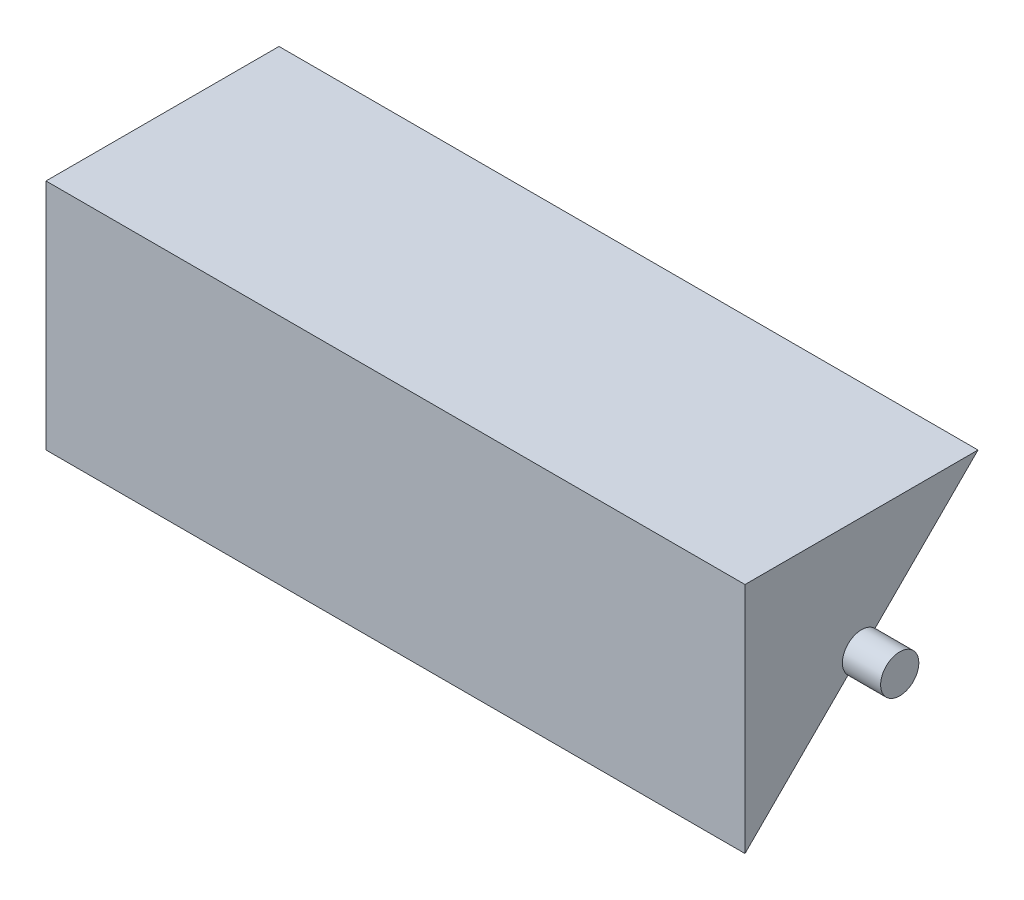
from build123d import *

# Parameters (mm, degrees)
SKETCH1_W                = 914.4
SKETCH1_H                = 304.8
BOSS_EXTRUDE1_DEPTH      = 304.8
CUT_EXTRUDE1_DEPTH       = 914.4
BOSS_EXTRUDE2_DEPTH      = 50
BOSS_EXTRUDE2_DEPTH_BACK = 976
SKETCH3_R                = 25


with BuildPart() as part:
    # Sketch1 → Boss-Extrude1 (new body)
    with BuildSketch(Plane.XY):
        Rectangle(SKETCH1_W, SKETCH1_H)
    extrude(amount=BOSS_EXTRUDE1_DEPTH)

    # Sketch2 → Cut-Extrude1 (cut)
    with BuildSketch(Plane(origin=(457.2, 0, 0), x_dir=(0, 0, -1), z_dir=(1, 0, 0))):
        Polygon((-304.8, -152.4), (0, 152.4), (0, -152.4), align=None)
    extrude(amount=-CUT_EXTRUDE1_DEPTH, mode=Mode.SUBTRACT)

    # Sketch3 → Boss-Extrude2 (add, two sides: drawn at the far end of the back side and taken through both)
    with BuildSketch(Plane(origin=(457.2, 0, 0), x_dir=(0, 0, -1), z_dir=(1, 0, 0)).offset(-BOSS_EXTRUDE2_DEPTH_BACK)):
        with Locations((-152.4, 0)):
            Circle(SKETCH3_R)
    extrude(amount=BOSS_EXTRUDE2_DEPTH + BOSS_EXTRUDE2_DEPTH_BACK)


solid = part.part
